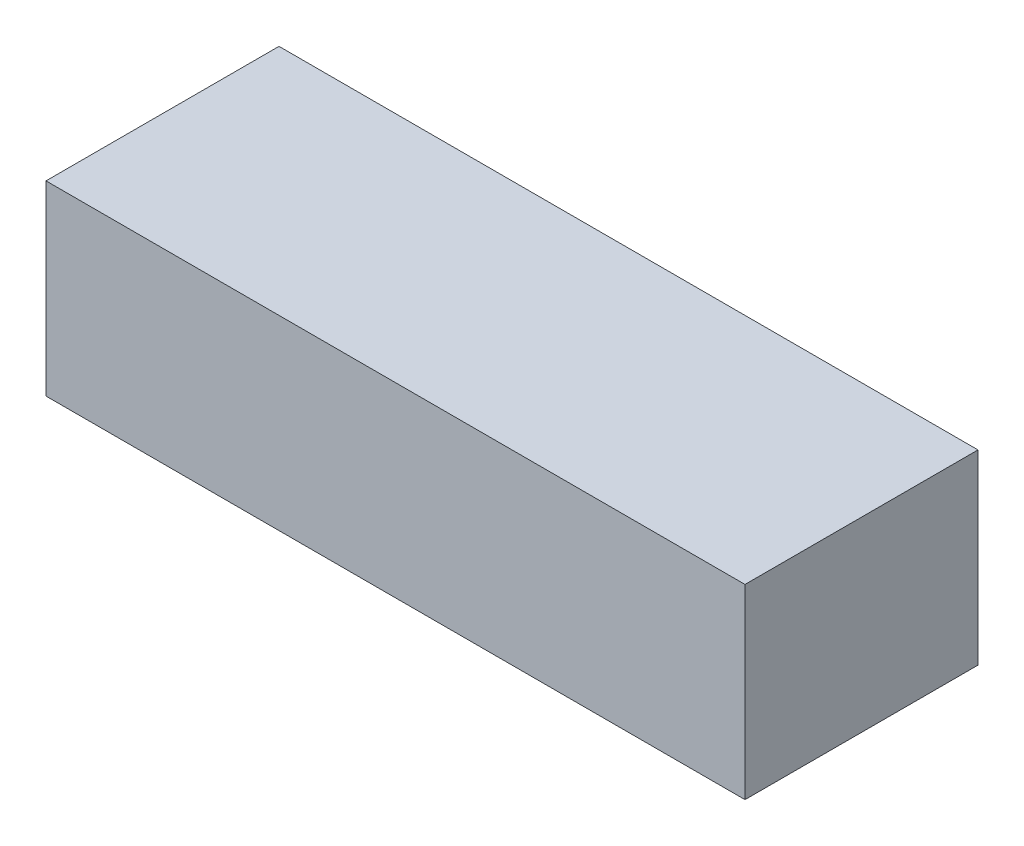
from build123d import *

# Parameters (mm, degrees)
SKETCH_1_W      = 30
SKETCH_1_H      = 8
EXTRUDE_1_DEPTH = 10


with BuildPart() as part:
    # Эскиз1 → Бобышка-Вытянуть1 (new body)
    with BuildSketch(Plane.XY):
        with Locations((15, 4)):
            Rectangle(SKETCH_1_W, SKETCH_1_H)
    extrude(amount=EXTRUDE_1_DEPTH)


solid = part.part
